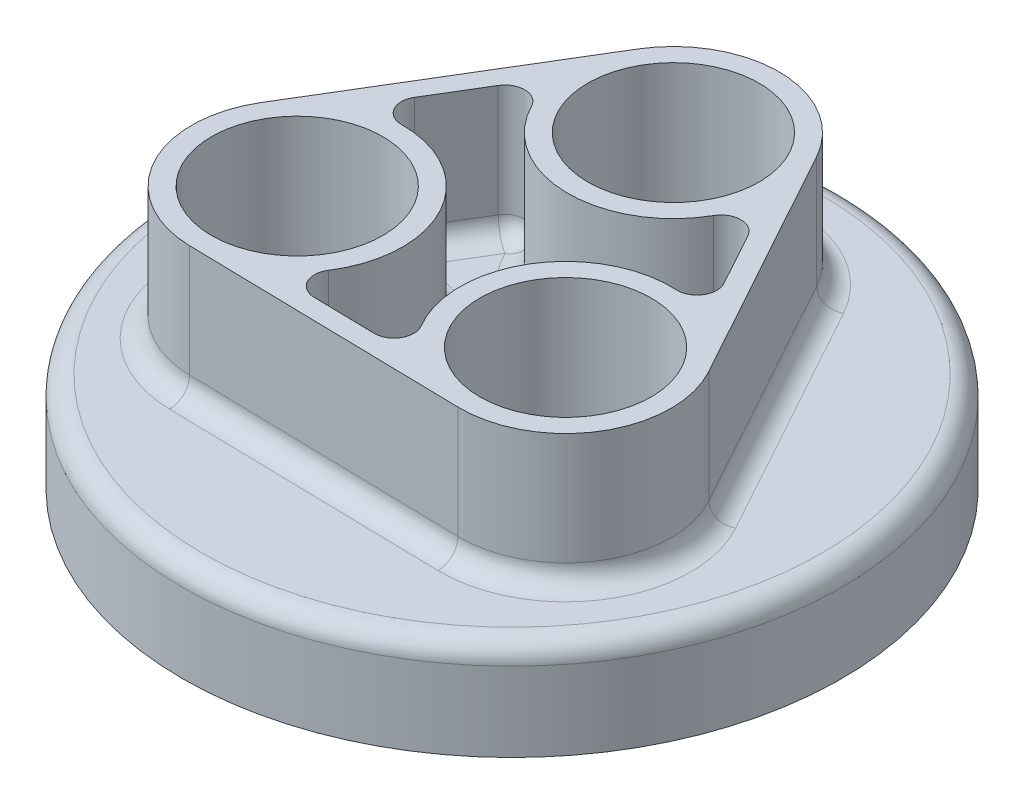
from build123d import *

# Parameters (mm, degrees)
SKETCH1_R           = 50
BOSS_EXTRUDE1_DEPTH = 15
SHELL1_T            = -3
SKETCH2_R           = 16
SKETCH2_R_2         = 13
BOSS_EXTRUDE2_DEPTH = 15
SKETCH3_R           = 13
CUT_EXTRUDE1_DEPTH  = 72.721684308
BOSS_EXTRUDE4_START = 20
SKETCH4_R           = 13
BOSS_EXTRUDE4_DEPTH = 20
FILLET1_R           = 3
FILLET2_R           = 3


with BuildPart() as part:
    # Sketch1 → Boss-Extrude1 (new body)
    with BuildSketch(Plane(origin=(0, 0, 0), x_dir=(1, 0, 0), z_dir=(0, 1, 0))):
        with Locations(Location((0, 0, 0), (0, 0, 270))):
            Circle(SKETCH1_R)
    extrude(amount=BOSS_EXTRUDE1_DEPTH)

    # Shell1
    shell1_openings = [part.faces().sort_by_distance(p)[0] for p in [
        (0, 0, 0),
    ]]
    offset(amount=SHELL1_T, openings=shell1_openings, kind=Kind.INTERSECTION)

    # Sketch2 → Boss-Extrude2 (add)
    # profile 1 of 3: a face of its own
    with BuildSketch(Plane(origin=(0, 15, 0), x_dir=(1, 0, 0), z_dir=(0, 1, 0))):
        with Locations(Location((-21.024365496, -11.574802612, 0), (0, 0, 270))):
            Circle(SKETCH2_R)
        with Locations(Location((-21.024365496, -11.574802612, 0), (0, 0, 270))):
            Circle(SKETCH2_R_2, mode=Mode.SUBTRACT)
    # profile 2 of 3: a face of its own
    with BuildSketch(Plane(origin=(0, 15, 0), x_dir=(1, 0, 0), z_dir=(0, 1, 0))):
        with Locations(Location((0.488109642, 23.995035924, 0), (0, 0, 270))):
            Circle(SKETCH2_R)
        with Locations(Location((0.488109642, 23.995035924, 0), (0, 0, 270))):
            Circle(SKETCH2_R_2, mode=Mode.SUBTRACT)
    # profile 3 of 3: a face of its own
    with BuildSketch(Plane(origin=(0, 15, 0), x_dir=(1, 0, 0), z_dir=(0, 1, 0))):
        with Locations(Location((20.536255854, -12.420233312, 0), (0, 0, 270))):
            Circle(SKETCH2_R)
        with Locations(Location((20.536255854, -12.420233312, 0), (0, 0, 270))):
            Circle(SKETCH2_R_2, mode=Mode.SUBTRACT)
    extrude(amount=-BOSS_EXTRUDE2_DEPTH)

    # Sketch3 → Cut-Extrude1 (cut, through all)
    with BuildSketch(Plane.XZ.offset(-12)):
        with Locations(Location((-21.024365496, 11.574802612, 0), (0, 0, 90))):
            Circle(SKETCH3_R)
        with Locations(Location((20.536255854, 12.420233312, 0), (0, 0, 90))):
            Circle(SKETCH3_R)
        with Locations(Location((0.488109642, -23.995035924, 0), (0, 0, 90))):
            Circle(SKETCH3_R)
    extrude(amount=-CUT_EXTRUDE1_DEPTH, mode=Mode.SUBTRACT)

    # Sketch4 → Boss-Extrude4 (add)
    with BuildSketch(Plane(origin=(0, 15, 0), x_dir=(1, 0, 0), z_dir=(0, 1, 0)).offset(BOSS_EXTRUDE4_START)):
        with BuildLine():
            Line((-34.715202731, -3.294647071), (-13.202727594, 32.275191465))
            ThreePointArc((-13.202727594, 32.275191465), (0.81351607, 39.991726539), (14.504353306, 31.711570998))
            Line((14.504353306, 31.711570998), (34.552499517, -4.703698237))
            ThreePointArc((34.552499517, -4.703698237), (34.227093089, -20.700388853), (20.210849425, -28.416923927))
            Line((20.210849425, -28.416923927), (-21.349771924, -27.571493228))
            ThreePointArc((-21.349771924, -27.571493228), (-35.040609159, -19.291337687), (-34.715202731, -3.294647071))
        make_face()
        with Locations(Location((20.536255854, -12.420233312, 0), (0, 0, 270))):
            Circle(SKETCH4_R, mode=Mode.SUBTRACT)
        with Locations(Location((0.488109642, 23.995035924, 0), (0, 0, 270))):
            Circle(SKETCH4_R, mode=Mode.SUBTRACT)
        with Locations(Location((-21.024365496, -11.574802612, 0), (0, 0, 270))):
            Circle(SKETCH4_R, mode=Mode.SUBTRACT)
        with BuildLine():
            Line((-27.321161415, 3.134050543), (-15.462704946, 22.741435523))
            ThreePointArc((-15.462704946, 22.741435523), (0.162703214, 7.998345308), (16.374748095, 22.093794575))
            Line((16.374748095, 22.093794575), (27.426013354, 2.020377533))
            ThreePointArc((27.426013354, 2.020377533), (6.845418618, -4.140077771), (10.94641332, -25.227845118))
            Line((10.94641332, -25.227845118), (-11.963308408, -24.761813056))
            ThreePointArc((-11.963308408, -24.761813056), (-7.008121832, -3.858267537), (-27.321161415, 3.134050543))
        make_face(mode=Mode.SUBTRACT)
    extrude(amount=-BOSS_EXTRUDE4_DEPTH)

    # Fillet1
    fillet1_edges = [part.edges().sort_by_distance(p)[0] for p in [
        (-7.008121832, 15, 3.858267537),
        (-0.508447544, 15, 24.994829087),
        (6.845418618, 15, 4.140077771),
        (21.900380725, 15, -12.057086054),
        (0.162703214, 15, -7.998345308),
        (-21.391933181, 15, -12.937743033),
        (-11.963308408, 25, 24.761813056),
        (10.94641332, 25, 25.227845118),
        (27.426013354, 25, -2.020377533),
        (16.374748095, 25, -22.093794575),
        (-15.462704946, 25, -22.741435523),
        (-27.321161415, 25, -3.134050543),
    ]]
    fillet(fillet1_edges, radius=FILLET1_R)

    # Fillet2
    fillet2_edges = [part.edges().sort_by_distance(p)[0] for p in [
        (-21.024365496, 12, -4.425197388),
        (0.488109642, 12, -39.995035924),
        (20.536255854, 12, -3.579766688),
        (0, 15, -50),
        (-35.040609159, 15, 19.291337687),
        (-0.569461249, 15, 27.994208578),
        (34.227093089, 15, 20.700388853),
        (24.528426412, 15, -13.503936381),
        (0.81351607, 15, -39.991726539),
        (-23.958965162, 15, -14.490272197),
        (0, 12, -47),
    ]]
    fillet(fillet2_edges, radius=FILLET2_R)


solid = part.part
